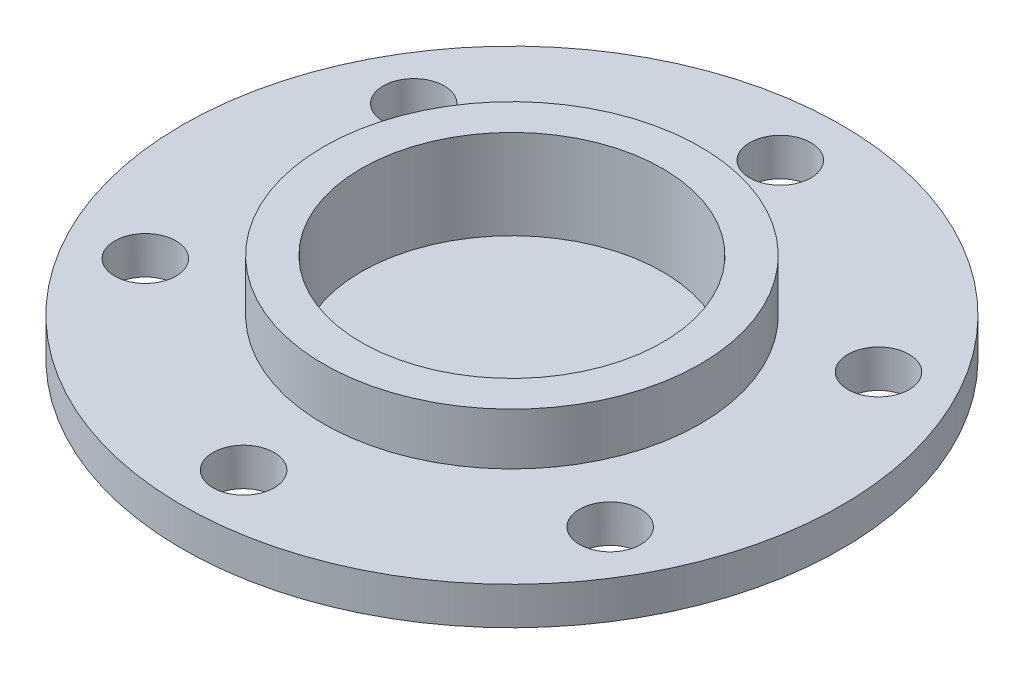
from build123d import *

# Parameters (mm, degrees)
SKETCH2_R          = 3.25
CUT_EXTRUDE1_DEPTH = 10


with BuildPart() as part:
    # Sketch1 → Revolve1 (revolve)
    with BuildSketch(Plane.XY):
        Polygon((0, -4), (0, -14.5), (-20.063981043, -4), (-35, -4), (-35, 0), (-20, 0), (-20, 5.5), (-16, 5.5), (-16, -4), align=None)
    revolve(axis=Axis((0, 0, 0), (0, -1, 0)))

    # Sketch2 → Cut-Extrude1 (cut)
    with BuildSketch(Plane.XZ.offset(4)):
        with Locations((0, 28.5)):
            Circle(SKETCH2_R)
        with Locations((24.681724008, 14.25)):
            Circle(SKETCH2_R)
        with Locations((24.681724008, -14.25)):
            Circle(SKETCH2_R)
        with Locations((0, -28.5)):
            Circle(SKETCH2_R)
        with Locations((-24.681724008, -14.25)):
            Circle(SKETCH2_R)
        with Locations((-24.681724008, 14.25)):
            Circle(SKETCH2_R)
    extrude(amount=-CUT_EXTRUDE1_DEPTH, mode=Mode.SUBTRACT)


solid = part.part
